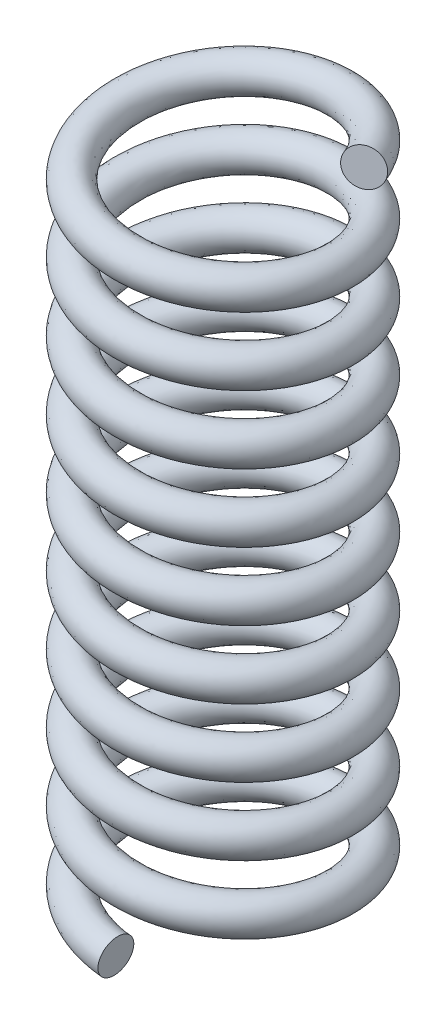
from build123d import *

# Parameters (mm, degrees)
SWEEP1_PITCH  = 19
SWEEP1_HEIGHT = 184
SWEEP1_RADIUS = 30
SKETCH4_R     = 5


with BuildPart() as part:
    # Sweep1: sweep along a helix
    with BuildLine() as sweep1_path:
        Helix(SWEEP1_PITCH, SWEEP1_HEIGHT, SWEEP1_RADIUS, center=(0, 0, 0), direction=(0, 1, 0), lefthand=True)
    # Sketch4 → Sweep1 (sweep)
    with BuildSketch(Plane(origin=(0, 0, 30), x_dir=(0, 0, 1), z_dir=(-0.9949582551571763, 0.10028993216962263, -1.336874068878081e-15))):
        Circle(SKETCH4_R)
    sweep(path=sweep1_path.line, is_frenet=True)


solid = part.part
